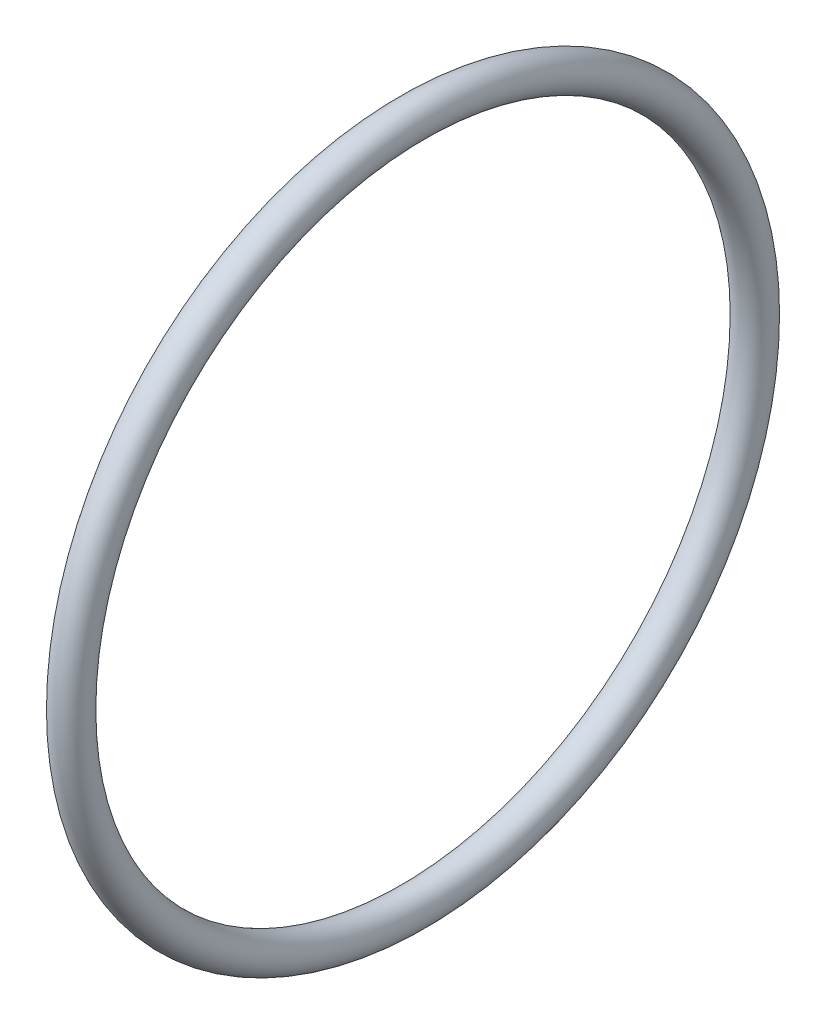
from build123d import *

# Parameters (mm, degrees)
SKETCH_1_R = 0.875


with BuildPart() as part:
    # 草图1 → 旋转1 (revolve)
    with BuildSketch(Plane.XY, mode=Mode.PRIVATE) as revolve_1_sk:
        with Locations((0, 17.125)):
            Circle(SKETCH_1_R)
    revolve(revolve_1_sk.sketch.rotate(Axis((0, 0, 0), (-1, 0, 0)), 90), axis=Axis((0, 0, 0), (-1, 0, 0)))


solid = part.part
